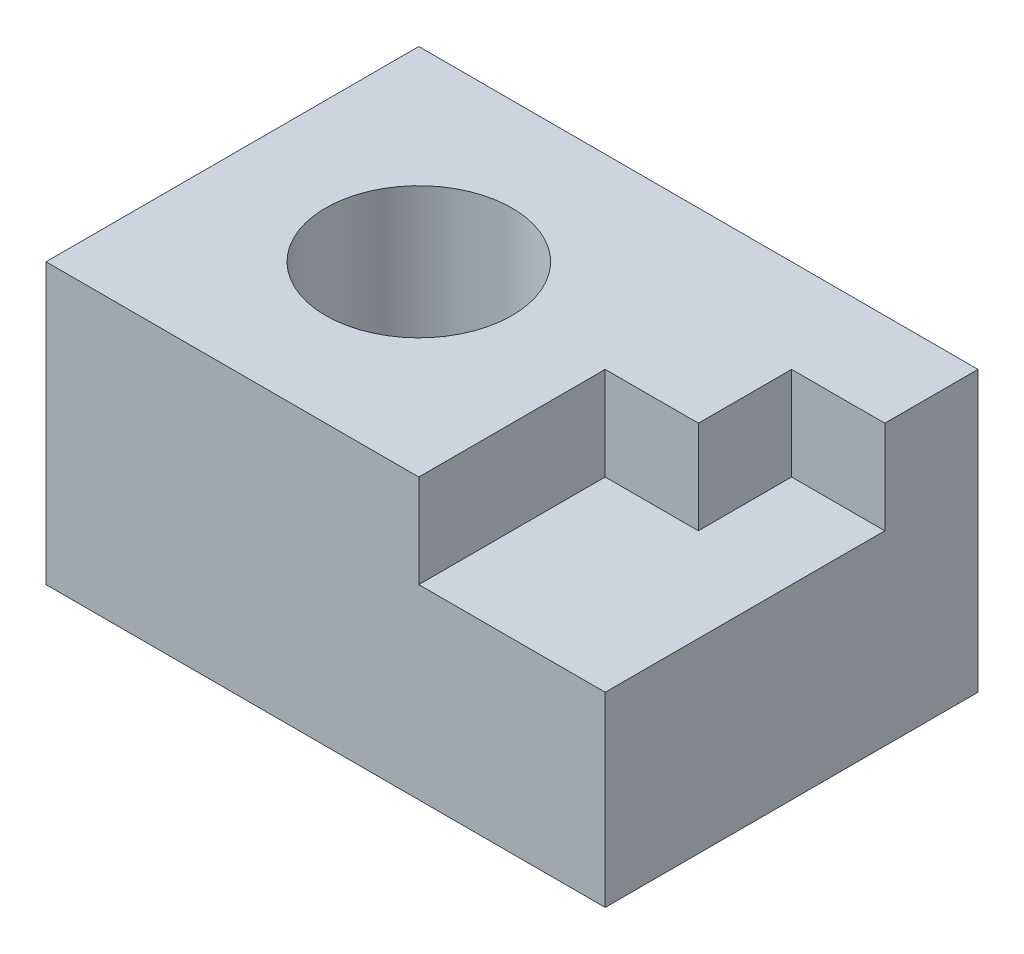
from build123d import *

# Parameters (mm, degrees)
SKETCH1_W           = 152.4
SKETCH1_H           = 101.6
BOSS_EXTRUDE1_DEPTH = 76.2
CUT_EXTRUDE1_DEPTH  = 25.4
SKETCH3_R           = 25.4
CUT_EXTRUDE2_DEPTH  = 199.380341768


with BuildPart() as part:
    # Sketch1 → Boss-Extrude1 (new body)
    with BuildSketch(Plane(origin=(0, 0, 0), x_dir=(1, 0, 0), z_dir=(0, 1, 0))):
        with Locations((76.2, 50.8)):
            Rectangle(SKETCH1_W, SKETCH1_H)
    extrude(amount=BOSS_EXTRUDE1_DEPTH)

    # Sketch2 → Cut-Extrude1 (cut)
    with BuildSketch(Plane(origin=(0, 76.2, 0), x_dir=(1, 0, 0), z_dir=(0, 1, 0))):
        Polygon((101.6, 0), (152.4, 0), (152.4, 76.2), (127, 76.2), (127, 50.8), (101.6, 50.8), align=None)
    extrude(amount=-CUT_EXTRUDE1_DEPTH, mode=Mode.SUBTRACT)

    # Sketch3 → Cut-Extrude2 (cut, through all)
    with BuildSketch(Plane(origin=(0, 76.2, 0), x_dir=(1, 0, 0), z_dir=(0, 1, 0))):
        with Locations(Location((50.8, 50.8, 0), (0, 0, 270))):
            Circle(SKETCH3_R)
    extrude(amount=-CUT_EXTRUDE2_DEPTH, mode=Mode.SUBTRACT)


solid = part.part
